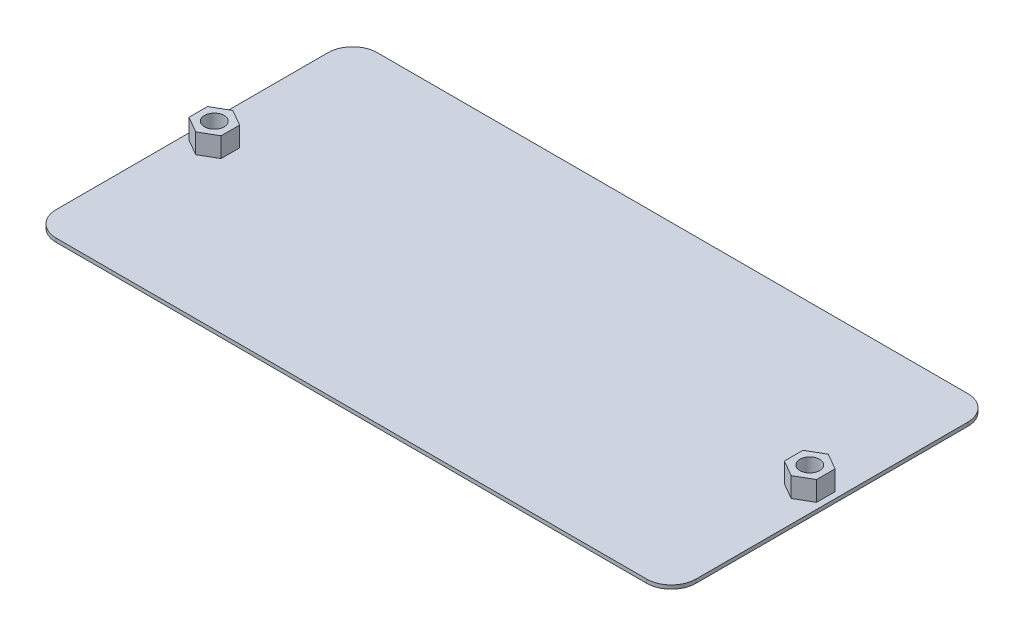
from build123d import *

# Parameters (mm, degrees)
SCHIZZO1_R                   = 4.5
ESTRUSIONE_ESTRUSIONE1_DEPTH = 1.5
SCHIZZO2_R                   = 4
ESTRUSIONE_ESTRUSIONE2_DEPTH = 8


with BuildPart() as part:
    # Schizzo1 → Estrusione-Estrusione1 (new body)
    with BuildSketch(Plane(origin=(0, 0, 0), x_dir=(1, 0, 0), z_dir=(0, 1, 0))):
        with BuildLine():
            Line((10, 0), (249, 0))
            ThreePointArc((249, 0), (256.071067812, 2.928932188), (259, 10))
            Line((259, 10), (259, 120))
            ThreePointArc((259, 120), (256.071067812, 127.071067812), (249, 130))
            Line((249, 130), (10, 130))
            ThreePointArc((10, 130), (2.928932188, 127.071067812), (0, 120))
            Line((0, 120), (0, 10))
            ThreePointArc((0, 10), (2.928932188, 2.928932188), (10, 0))
        make_face()
        with Locations(Location((9, 65, 0), (0, 0, 270))):
            Circle(SCHIZZO1_R, mode=Mode.SUBTRACT)
        with Locations(Location((250, 65, 0), (0, 0, 90))):
            Circle(SCHIZZO1_R, mode=Mode.SUBTRACT)
    extrude(amount=ESTRUSIONE_ESTRUSIONE1_DEPTH)

    # Schizzo2 → Estrusione-Estrusione2 (add)
    # profile 1 of 2: a face of its own
    with BuildSketch(Plane(origin=(0, 1.5, 0), x_dir=(-1, 0, 0), z_dir=(0, 1, 0))):
        Polygon((-9, -57.494446501), (-15.5, -61.24722325), (-15.5, -68.75277675), (-9, -72.505553499), (-2.5, -68.75277675), (-2.5, -61.24722325), align=None)
        with Locations(Location((-9, -65, 0), (0, 0, 270))):
            Circle(SCHIZZO2_R, mode=Mode.SUBTRACT)
    # profile 2 of 2: a face of its own
    with BuildSketch(Plane(origin=(0, 1.5, 0), x_dir=(-1, 0, 0), z_dir=(0, 1, 0))):
        Polygon((-256.5, -61.24722325), (-250, -57.494446501), (-243.5, -61.24722325), (-243.5, -68.75277675), (-250, -72.505553499), (-256.5, -68.75277675), align=None)
        with Locations(Location((-250, -65, 0), (0, 0, 90))):
            Circle(SCHIZZO2_R, mode=Mode.SUBTRACT)
    extrude(amount=ESTRUSIONE_ESTRUSIONE2_DEPTH)


solid = part.part
